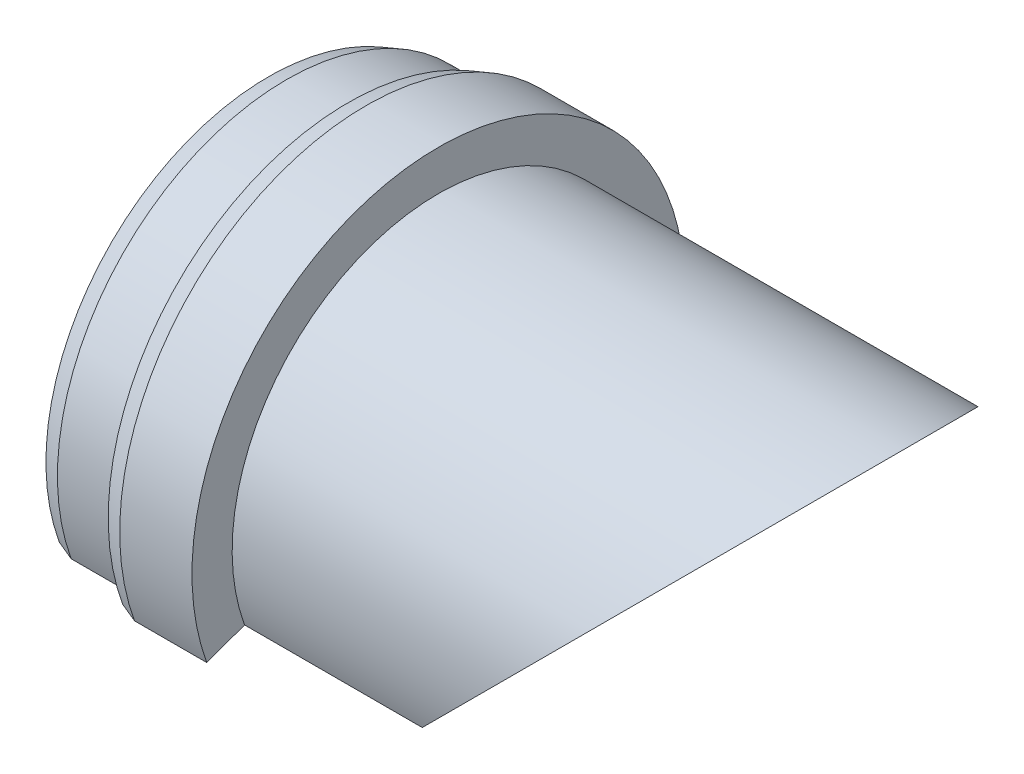
from build123d import *
from OCP.BRepFilletAPI import BRepFilletAPI_MakeChamfer

# Parameters (mm, degrees)
CUT_EXTRUDE1_DEPTH      = 198.818204546
CUT_EXTRUDE1_DEPTH_BACK = 198.818204546
CHAMFER1_SIZE           = 5
CHAMFER1_SIZE2          = 1.819851171
CUT_EXTRUDE3_DEPTH      = 198.818204546
CUT_EXTRUDE3_DEPTH_BACK = 198.818204546


with BuildPart() as part:
    # Sketch1 → Revolve1 (revolve)
    with BuildSketch(Plane.XY):
        Polygon((0, 55.05), (172.74, 55.05), (172.74, 57.05), (47, 57.05), (47, 68.165), (22, 68.165), (22, 63.4), (0, 63.4), align=None)
    revolve(axis=Axis((0, 0, 0), (1, 0, 0)))

    # Sketch1<3> → Cut-Extrude1 (cut, two sides: drawn at the far end of the back side and taken through both)
    with BuildSketch(Plane.XY.offset(-CUT_EXTRUDE1_DEPTH_BACK)):
        Polygon((182.74, 67.05), (-17.26, -132.95), (182.74, -132.95), align=None)
    extrude(amount=CUT_EXTRUDE1_DEPTH + CUT_EXTRUDE1_DEPTH_BACK, mode=Mode.SUBTRACT)

    # Chamfer1: one chamfer whose edges measure the first distance from different faces: ONE call of the kernel's chamfer builder (chamfer() names one face for all edges)
    chamfer1_edges_1 = [part.edges().sort_by_distance(p)[0] for p in [
        (0, -63.4, 0),
    ]]
    chamfer1_side_1 = [part.faces().sort_by_distance(p)[0] for p in [
        (11, -63.4, 0),
    ]]
    chamfer1_edges_2 = [part.edges().sort_by_distance(p)[0] for p in [
        (22, -68.165, 0),
    ]]
    chamfer1_side_2 = [part.faces().sort_by_distance(p)[0] for p in [
        (34.5, -68.165, 0),
    ]]
    chamfer1 = BRepFilletAPI_MakeChamfer(part.part.solid().wrapped)
    for e in chamfer1_edges_1:
        chamfer1.Add(CHAMFER1_SIZE, CHAMFER1_SIZE2, e.wrapped, chamfer1_side_1[0].wrapped)  # the first distance lies on this face
    for e in chamfer1_edges_2:
        chamfer1.Add(CHAMFER1_SIZE, CHAMFER1_SIZE2, e.wrapped, chamfer1_side_2[0].wrapped)  # the first distance lies on this face
    add(Compound.cast(chamfer1.Shape()), mode=Mode.REPLACE)

    # Sketch2 → Cut-Extrude3 (cut, two sides: drawn at the far end of the back side and taken through both)
    with BuildSketch(Plane(origin=(0, 0, 0), x_dir=(0, 0, -1), z_dir=(1, 0, 0)).offset(-CUT_EXTRUDE3_DEPTH_BACK)):
        Polygon((0, 0), (-302.22251614, -110), (19.395967878, -110), align=None)
    extrude(amount=CUT_EXTRUDE3_DEPTH + CUT_EXTRUDE3_DEPTH_BACK, mode=Mode.SUBTRACT)


solid = part.part
